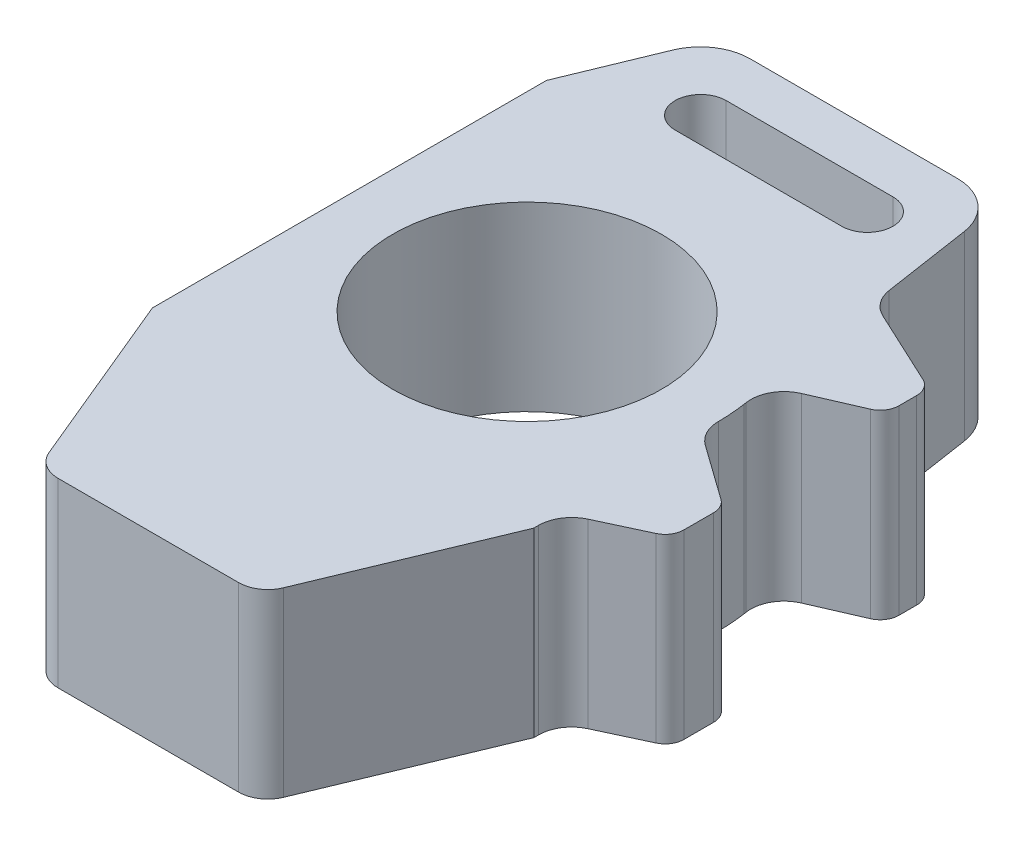
from build123d import *

# Parameters (mm, degrees)
BOSS_EXTRUDE1_DEPTH      = 28.22702
BOSS_EXTRUDE1_DEPTH_BACK = 27.08402
SKETCH2_R                = 40.9575
CUT_EXTRUDE1_DEPTH       = 152.701320166
CUT_EXTRUDE2_DEPTH       = 152.701320166


with BuildPart() as part:
    # Sketch1 → Boss-Extrude1 (new, two sides: drawn at the far end of the back side and taken through both)
    with BuildSketch(Plane(origin=(0, 0, 0), x_dir=(1, 0, 0), z_dir=(0, 1, 0)).offset(-BOSS_EXTRUDE1_DEPTH_BACK)):
        with BuildLine():
            Line((-35.721676258, -109.931199839), (-58.1025, -56.069211009))
            Line((-58.1025, -56.069211009), (-58.1025, -54.569599156))
            Line((-58.1025, -54.569599156), (-58.1025, 64.002262273))
            Line((-58.1025, 64.002262273), (-46.861446545, 91.314524953))
            ThreePointArc((-46.861446545, 91.314524953), (-41.24957855, 98.176226775), (-32.76841286, 100.75418))
            Line((-32.76841286, 100.75418), (30.359183597, 100.75418))
            ThreePointArc((30.359183597, 100.75418), (40.293026824, 97.071703902), (45.426195478, 87.803885872))
            Line((45.426195478, 87.803885872), (49.528165732, 60.811582924))
            ThreePointArc((49.528165732, 60.811582924), (51.439588659, 56.249062009), (55.27903878, 53.129966389))
            Line((55.27903878, 53.129966389), (78.152801145, 42.463755827))
            ThreePointArc((78.152801145, 42.463755827), (80.557519892, 40.354874086), (81.452537779, 37.284206824))
            Line((81.452537779, 37.284206824), (81.452537779, 31.863274858))
            ThreePointArc((81.452537779, 31.863274858), (80.517086587, 28.730043586), (78.016968856, 26.622528826))
            Line((78.016968856, 26.622528826), (63.334487079, 20.236471377))
            ThreePointArc((63.334487079, 20.236471377), (58.494345864, 15.83382392), (57.342134405, 9.393118961))
            Line((57.342134405, 9.393118961), (57.442982796, 8.729503635))
            ThreePointArc((57.442982796, 8.729503635), (57.930235286, 4.470832805), (58.1021964, 0.187828999))
            ThreePointArc((58.1021964, 0.187828999), (59.236377824, -4.444212154), (62.359072928, -8.048507927))
            Line((62.359072928, -8.048507927), (79.05801487, -19.969280438))
            ThreePointArc((79.05801487, -19.969280438), (80.818765563, -22.004906493), (81.452537779, -24.620694942))
            Line((81.452537779, -24.620694942), (81.452537779, -33.663524119))
            ThreePointArc((81.452537779, -33.663524119), (80.557519892, -36.73419138), (78.152801145, -38.843073121))
            Line((78.152801145, -38.843073121), (63.968698461, -45.457228827))
            ThreePointArc((63.968698461, -45.457228827), (59.714275337, -49.174099767), (58.102788562, -54.588742513))
            ThreePointArc((58.102788562, -54.588742513), (58.102572141, -54.627028957), (58.1025, -54.665315944))
            Line((58.1025, -54.665315944), (58.1025, -56.069211009))
            Line((58.1025, -56.069211009), (35.721676258, -109.931199839))
            ThreePointArc((35.721676258, -109.931199839), (32.447083012, -113.91449974), (27.512189111, -115.40998))
            Line((27.512189111, -115.40998), (-27.512189111, -115.40998))
            ThreePointArc((-27.512189111, -115.40998), (-32.447083012, -113.91449974), (-35.721676258, -109.931199839))
        make_face()
    extrude(amount=BOSS_EXTRUDE1_DEPTH + BOSS_EXTRUDE1_DEPTH_BACK)

    # Sketch2 → Cut-Extrude1 (cut, through all)
    with BuildSketch(Plane(origin=(0, 28.22702, 0), x_dir=(1, 0, 0), z_dir=(0, 1, 0))):
        with Locations(Location((0, 0, 0), (0, 0, 270))):
            Circle(SKETCH2_R)
    extrude(amount=-CUT_EXTRUDE1_DEPTH, mode=Mode.SUBTRACT)

    # Sketch3 → Cut-Extrude2 (cut, through all)
    with BuildSketch(Plane(origin=(0, 28.22702, 0), x_dir=(1, 0, 0), z_dir=(0, 1, 0))):
        with BuildLine():
            Line((25.4, 86.078568), (-25.4, 86.078568))
            ThreePointArc((-25.4, 86.078568), (-33.081115057, 79.561637348), (-27.902461028, 70.921529936))
            ThreePointArc((-27.902461028, 70.921529936), (-26.668169348, 70.612352943), (-25.4, 70.508368))
            Line((-25.4, 70.508368), (25.4, 70.508368))
            ThreePointArc((25.4, 70.508368), (26.668169348, 70.612352943), (27.902461028, 70.921529936))
            ThreePointArc((27.902461028, 70.921529936), (33.081115057, 79.561637348), (25.4, 86.078568))
        make_face()
    extrude(amount=-CUT_EXTRUDE2_DEPTH, mode=Mode.SUBTRACT)


solid = part.part
